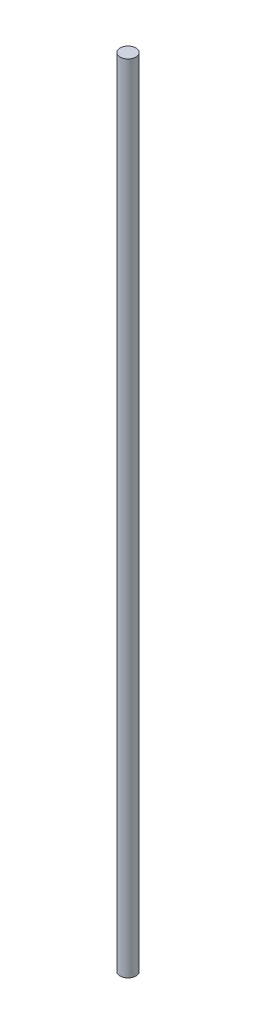
from build123d import *

# Parameters (mm, degrees)
EXTRUDE1_DEPTH      = 45.5
EXTRUDE1_DEPTH_BACK = 4.5
SKETCH1_R           = 0.5


with BuildPart() as part:
    # Sketch1 → Extrude1 (new, two sides: drawn at the far end of the back side and taken through both)
    with BuildSketch(Plane(origin=(0, 0, 0), x_dir=(1, 0, 0), z_dir=(0, 1, 0)).offset(-EXTRUDE1_DEPTH_BACK)):
        with Locations(Location((0, 0, 0), (0, 0, 270))):
            Circle(SKETCH1_R)
    extrude(amount=EXTRUDE1_DEPTH + EXTRUDE1_DEPTH_BACK)


solid = part.part
